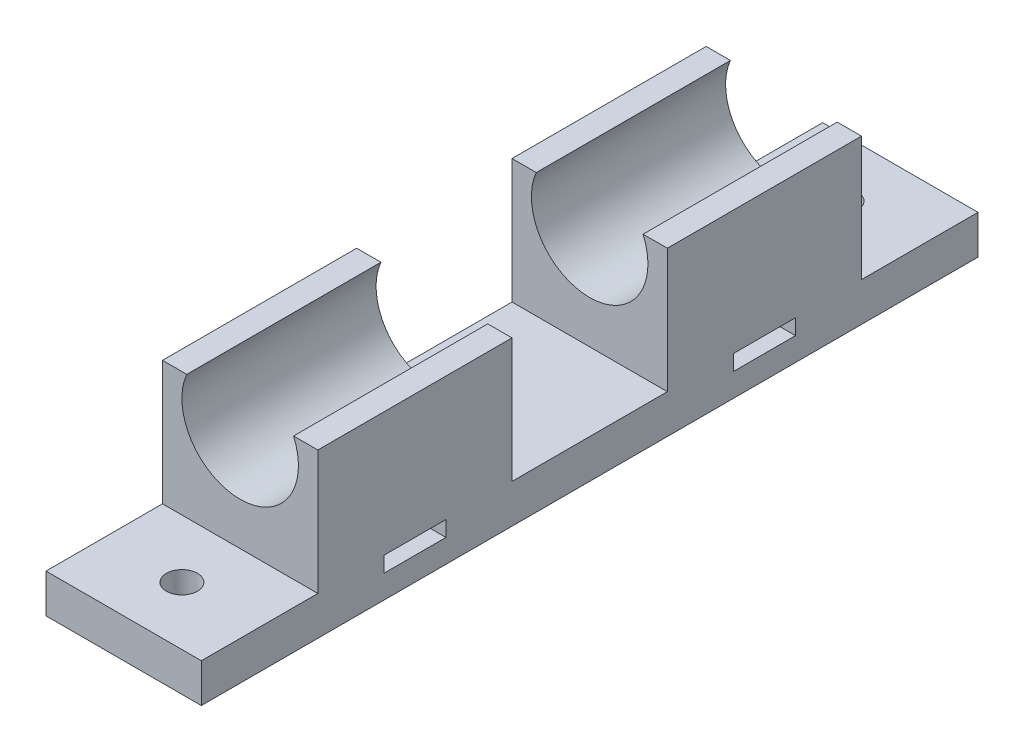
from build123d import *

# Parameters (mm, degrees)
ESBO_O1_W                = 8
ESBO_O1_H                = 2
RESSALTO_EXTRUS_O1_DEPTH = 10
CORTE_EXTRUS_O1_REACH    = 75.763
ESBO_O4_W                = 20
ESBO_O4_H                = 15
ESBO_O4_R                = 2
RESSALTO_EXTRUS_O2_DEPTH = 5


with BuildPart() as part:
    # Esboço1 → Ressalto-extrusão1 (new, symmetric)
    with BuildSketch(Plane(origin=(0, 0, 0), x_dir=(0, 0, -1), z_dir=(1, 0, 0))):
        Polygon((-35, 21), (-10, 21), (-10, 5), (10, 5), (10, 21), (35, 21), (35, 0), (-35, 0), align=None)
        with Locations((-22.5, 4)):
            Rectangle(ESBO_O1_W, ESBO_O1_H, mode=Mode.SUBTRACT)
        with Locations((22.5, 4)):
            Rectangle(ESBO_O1_W, ESBO_O1_H, mode=Mode.SUBTRACT)
    extrude(amount=RESSALTO_EXTRUS_O1_DEPTH, both=True)

    # Corte-extrusão1: up to this face of the body (flat: up to its plane)
    corte_extrus_o1_end = Plane(part.part.faces().sort_by_distance((0, 10.5, -35))[0])
    # Esboço2 → Corte-extrusão1 (cut, up to the picked face)
    with BuildSketch(Plane.XY.offset(35), mode=Mode.PRIVATE) as corte_extrus_o1_sk1:
        with BuildLine():
            Line((-6.873863542, 21), (6.873863542, 21))
            ThreePointArc((6.873863542, 21), (0, 10.5), (-6.873863542, 21))
        make_face()
    corte_extrus_o1_tool1 = split(extrude(corte_extrus_o1_sk1.sketch, amount=-CORTE_EXTRUS_O1_REACH, mode=Mode.PRIVATE), bisect_by=corte_extrus_o1_end, keep=Keep.BOTH, mode=Mode.PRIVATE)
    add(corte_extrus_o1_tool1.solids().sort_by(Axis((0, 16.361219, 35), (0, 0, -1)))[0], mode=Mode.SUBTRACT)

    # Esboço4 → Ressalto-extrusão2 (add)
    # profile 1 of 2: a face of its own
    with BuildSketch(Plane(origin=(0, 5, 0), x_dir=(1, 0, 0), z_dir=(0, 1, 0))):
        with Locations((0, 42.5)):
            Rectangle(ESBO_O4_W, ESBO_O4_H)
        with Locations(Location((0, 42.5, 0), (0, 0, 270))):
            Circle(ESBO_O4_R, mode=Mode.SUBTRACT)
    # profile 2 of 2: a face of its own
    with BuildSketch(Plane(origin=(0, 5, 0), x_dir=(1, 0, 0), z_dir=(0, 1, 0))):
        with Locations((0, -42.5)):
            Rectangle(ESBO_O4_W, ESBO_O4_H)
        with Locations(Location((0, -42.5, 0), (0, 0, 270))):
            Circle(ESBO_O4_R, mode=Mode.SUBTRACT)
    extrude(amount=-RESSALTO_EXTRUS_O2_DEPTH)


solid = part.part
